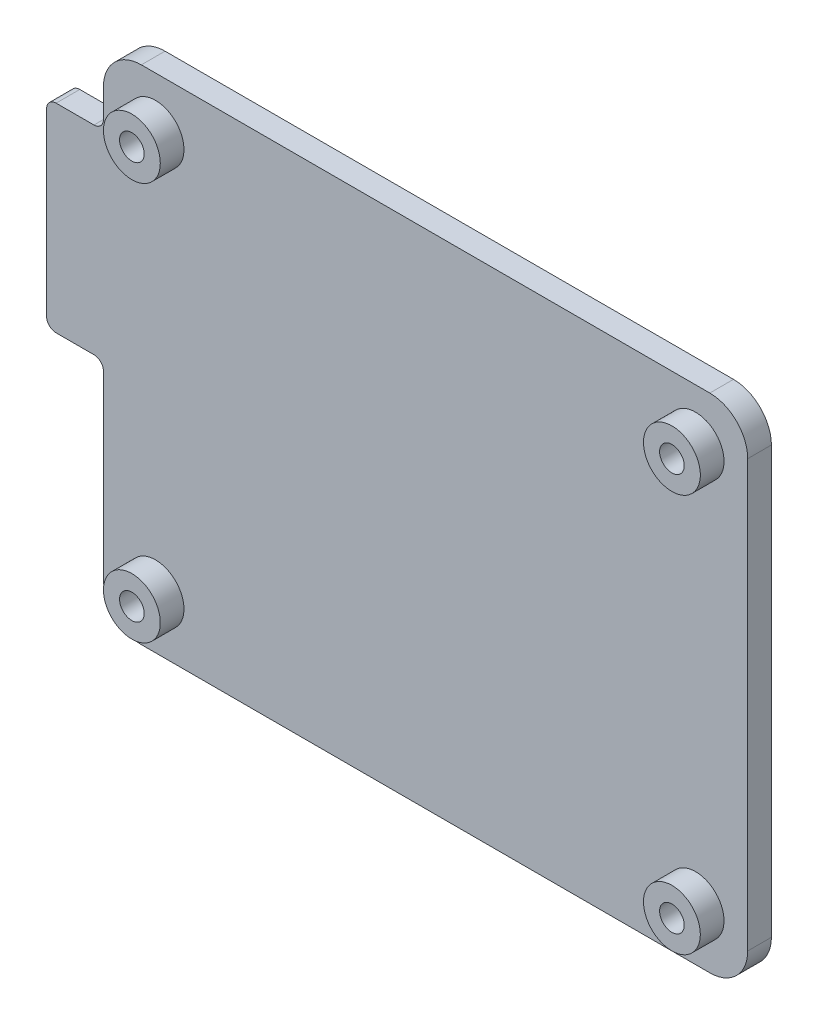
from build123d import *

# Parameters (mm, degrees)
ESBO_O1_W                = 68
ESBO_O1_H                = 53
RESSALTO_EXTRUS_O1_DEPTH = 2.5
ESBO_O2_R                = 3
ESBO_O2_R_2              = 1.3
RESSALTO_EXTRUS_O2_DEPTH = 2.5
FILETE1_R                = 4
CORTE_EXTRUS_O1_START    = -0.7
ESBO_O13_R               = 2.2
CORTE_EXTRUS_O1_DEPTH    = 43.479856415
ESBO_O14_R               = 1.3
CORTE_EXTRUS_O2_DEPTH    = 44.179856415
ESBO_O16_W               = 6
ESBO_O16_H               = 21
RESSALTO_EXTRUS_O4_DEPTH = 2.5
FILETE2_R                = 1


with BuildPart() as part:
    # Esboço1 → Ressalto-extrusão1 (new body)
    with BuildSketch(Plane.XY):
        Rectangle(ESBO_O1_W, ESBO_O1_H)
    extrude(amount=RESSALTO_EXTRUS_O1_DEPTH)

    # Esboço2 → Ressalto-extrusão2 (add)
    # profile 1 of 4: a face of its own
    with BuildSketch(Plane.XY.offset(2.5)):
        with Locations(Location((-28.5, 21, 0), (0, 0, 180))):
            Circle(ESBO_O2_R)
        with Locations((-28.5, 21)):
            Circle(ESBO_O2_R_2, mode=Mode.SUBTRACT)
    # profile 2 of 4: a face of its own
    with BuildSketch(Plane.XY.offset(2.5)):
        with Locations(Location((-28.5, -21, 0), (0, 0, 180))):
            Circle(ESBO_O2_R)
        with Locations(Location((-28.5, -21, 0), (0, 0, 180))):
            Circle(ESBO_O2_R_2, mode=Mode.SUBTRACT)
    # profile 3 of 4: a face of its own
    with BuildSketch(Plane.XY.offset(2.5)):
        with Locations(Location((28.5, -21, 0), (0, 0, 180))):
            Circle(ESBO_O2_R)
        with Locations((28.5, -21)):
            Circle(ESBO_O2_R_2, mode=Mode.SUBTRACT)
    # profile 4 of 4: a face of its own
    with BuildSketch(Plane.XY.offset(2.5)):
        with Locations(Location((28.5, 21, 0), (0, 0, 180))):
            Circle(ESBO_O2_R)
        with Locations(Location((28.5, 21, 0), (0, 0, 180))):
            Circle(ESBO_O2_R_2, mode=Mode.SUBTRACT)
    extrude(amount=RESSALTO_EXTRUS_O2_DEPTH)

    # Filete1
    filete1_edges = [part.edges().sort_by_distance(p)[0] for p in [
        (34, -26.5, 1.25),
        (-34, -26.5, 1.25),
        (-34, 26.5, 1.25),
        (34, 26.5, 1.25),
    ]]
    fillet(filete1_edges, radius=FILETE1_R)

    # Esboço13 → Corte-extrusão1 (cut, through all)
    with BuildSketch(Plane.XY.offset(2.5).offset(CORTE_EXTRUS_O1_START)):
        with Locations((-28.5, 21)):
            Circle(ESBO_O13_R)
        with Locations(Location((-28.5, -21, 0), (0, 0, 180))):
            Circle(ESBO_O13_R)
        with Locations((28.5, -21)):
            Circle(ESBO_O13_R)
        with Locations(Location((28.5, 21, 0), (0, 0, 180))):
            Circle(ESBO_O13_R)
    extrude(amount=-CORTE_EXTRUS_O1_DEPTH, mode=Mode.SUBTRACT)

    # Esboço14 → Corte-extrusão2 (cut, through all)
    with BuildSketch(Plane.XY.offset(2.5)):
        with Locations((-28.5, 21)):
            Circle(ESBO_O14_R)
        with Locations(Location((28.5, 21, 0), (0, 0, 180))):
            Circle(ESBO_O14_R)
        with Locations((28.5, -21)):
            Circle(ESBO_O14_R)
        with Locations(Location((-28.5, -21, 0), (0, 0, 180))):
            Circle(ESBO_O14_R)
    extrude(amount=-CORTE_EXTRUS_O2_DEPTH, mode=Mode.SUBTRACT)

    # Esboço16 → Ressalto-extrusão4 (add, through all)
    with BuildSketch(Plane.XY.offset(2.5)):
        with Locations((-37, 8)):
            Rectangle(ESBO_O16_W, ESBO_O16_H)
    extrude(amount=-RESSALTO_EXTRUS_O4_DEPTH)

    # Filete2
    filete2_edges = [part.edges().sort_by_distance(p)[0] for p in [
        (-34, 18.5, 1.25),
        (-34, -2.5, 1.25),
        (-40, -2.5, 1.25),
        (-40, 18.5, 1.25),
    ]]
    fillet(filete2_edges, radius=FILETE2_R)


solid = part.part
